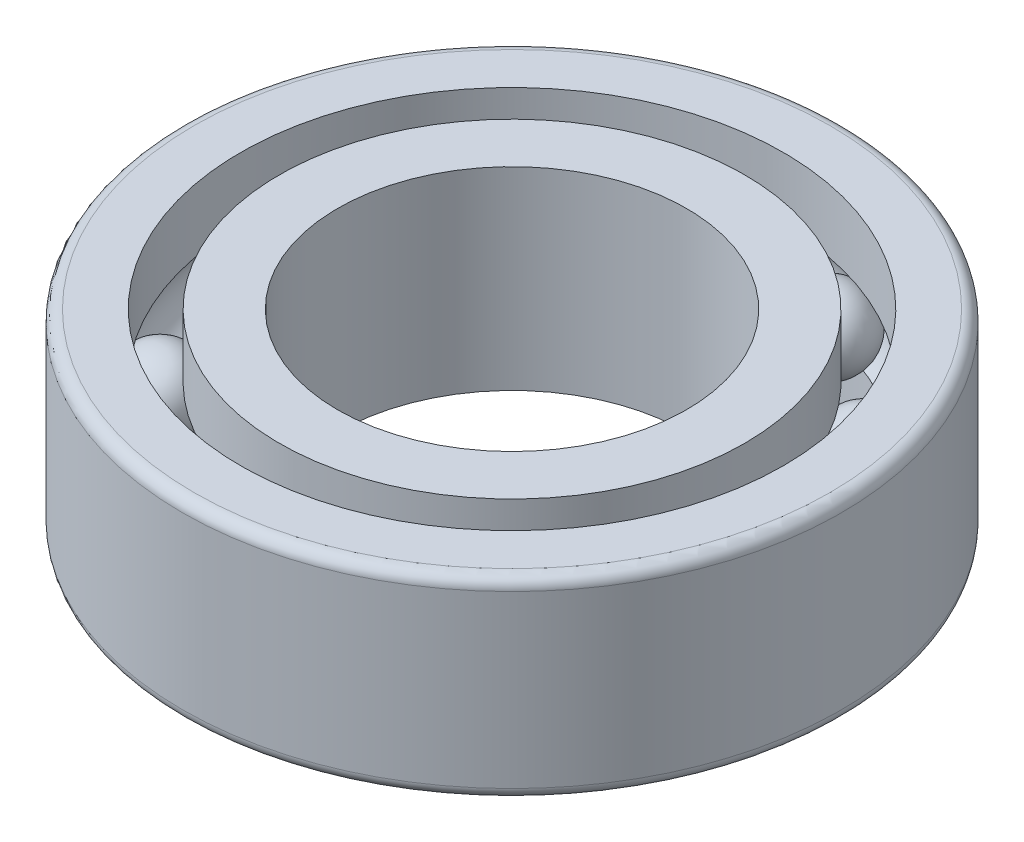
from build123d import *

# Parameters (mm, degrees)
SKETCH_1_R               = 8.5
SKETCH_1_R_2             = 4.5
EXTRUDE_1_DEPTH          = 2.5
FILLET_1_R               = 0.3
SKETCH_2_R               = 1
PATTERN_CIRCULAR_1_COUNT = 10


with BuildPart() as part:
    # 草图1 → 凸台-拉伸1 (new, symmetric)
    with BuildSketch(Plane(origin=(0, 0, 0), x_dir=(1, 0, 0), z_dir=(0, 1, 0))):
        with Locations(Location((0, 0, 0), (0, 0, 270))):
            Circle(SKETCH_1_R)
        with Locations(Location((0, 0, 0), (0, 0, 270))):
            Circle(SKETCH_1_R_2, mode=Mode.SUBTRACT)
    extrude(amount=EXTRUDE_1_DEPTH, both=True)

    # 圆角1
    fillet_1_edges = [part.edges().sort_by_distance(p)[0] for p in [
        (0, -2.5, -8.5),
        (0, 2.5, -8.5),
    ]]
    fillet(fillet_1_edges, radius=FILLET_1_R)

    # 草图2 → 切除-旋转1 (revolve, cut)
    with BuildSketch(Plane.XY, mode=Mode.PRIVATE) as cut_revolve_1_sk:
        with BuildLine():
            ThreePointArc((-7, 0.866025404), (-6.5, 1), (-6, 0.866025404))
            Line((-6, 0.866025404), (-6, 2.5))
            Line((-6, 2.5), (-7, 2.5))
            Line((-7, 2.5), (-7, 0.866025404))
        make_face()
        with Locations((-6.5, 0)):
            Circle(SKETCH_2_R)
        with BuildLine():
            Line((-6, -2.5), (-6, -0.866025404))
            ThreePointArc((-6, -0.866025404), (-6.5, -1), (-7, -0.866025404))
            Line((-7, -0.866025404), (-7, -2.5))
            Line((-7, -2.5), (-6, -2.5))
        make_face()
    revolve(cut_revolve_1_sk.sketch.rotate(Axis((0, -1000, 0), (0, 1, 0)), 180), axis=Axis((0, -1000, 0), (0, 1, 0)), mode=Mode.SUBTRACT)


with BuildPart() as cut_revolve_1_piece_1:
    # of the separate pieces the step leaves, piece 1, a body of its own (cut_revolve_1_pieces)
    add(part.part.solids().sort_by_distance((0, -2.2, 8.5))[0])


with BuildPart() as cut_revolve_1_piece_2:
    # of the separate pieces the step leaves, piece 2, a body of its own (cut_revolve_1_pieces)
    add(part.part.solids().sort_by_distance((6, -2.5, 0))[0])


with BuildPart() as body_3:
    # 草图3 → 旋转1 (revolve)
    with BuildSketch(Plane.XY):
        with BuildLine():
            Line((-6.5, -1), (-6.5, 1))
            ThreePointArc((-6.5, 1), (-7.5, 0), (-6.5, -1))
        make_face()
    revolve(axis=Axis((-6.5, -999.894878115, 0), (0, 1, 0)))


with BuildPart() as pattern_circular_1_1:
    # 阵列(圆周)1: pattern copy
    add(body_3.part.rotate(Axis((0, 0, 0), (0, 1, 0)), 1 * 360 / PATTERN_CIRCULAR_1_COUNT))


with BuildPart() as pattern_circular_1_2:
    # 阵列(圆周)1: pattern copy
    add(body_3.part.rotate(Axis((0, 0, 0), (0, 1, 0)), 2 * 360 / PATTERN_CIRCULAR_1_COUNT))


with BuildPart() as pattern_circular_1_3:
    # 阵列(圆周)1: pattern copy
    add(body_3.part.rotate(Axis((0, 0, 0), (0, 1, 0)), 3 * 360 / PATTERN_CIRCULAR_1_COUNT))


with BuildPart() as pattern_circular_1_4:
    # 阵列(圆周)1: pattern copy
    add(body_3.part.rotate(Axis((0, 0, 0), (0, 1, 0)), 4 * 360 / PATTERN_CIRCULAR_1_COUNT))


with BuildPart() as pattern_circular_1_5:
    # 阵列(圆周)1: pattern copy
    add(body_3.part.rotate(Axis((0, 0, 0), (0, 1, 0)), 5 * 360 / PATTERN_CIRCULAR_1_COUNT))


with BuildPart() as pattern_circular_1_6:
    # 阵列(圆周)1: pattern copy
    add(body_3.part.rotate(Axis((0, 0, 0), (0, 1, 0)), 6 * 360 / PATTERN_CIRCULAR_1_COUNT))


with BuildPart() as pattern_circular_1_7:
    # 阵列(圆周)1: pattern copy
    add(body_3.part.rotate(Axis((0, 0, 0), (0, 1, 0)), 7 * 360 / PATTERN_CIRCULAR_1_COUNT))


with BuildPart() as pattern_circular_1_8:
    # 阵列(圆周)1: pattern copy
    add(body_3.part.rotate(Axis((0, 0, 0), (0, 1, 0)), 8 * 360 / PATTERN_CIRCULAR_1_COUNT))


with BuildPart() as pattern_circular_1_9:
    # 阵列(圆周)1: pattern copy
    add(body_3.part.rotate(Axis((0, 0, 0), (0, 1, 0)), 9 * 360 / PATTERN_CIRCULAR_1_COUNT))


solid = Compound([cut_revolve_1_piece_1.part, cut_revolve_1_piece_2.part, body_3.part, pattern_circular_1_1.part, pattern_circular_1_2.part, pattern_circular_1_3.part, pattern_circular_1_4.part, pattern_circular_1_5.part, pattern_circular_1_6.part, pattern_circular_1_7.part, pattern_circular_1_8.part, pattern_circular_1_9.part])
